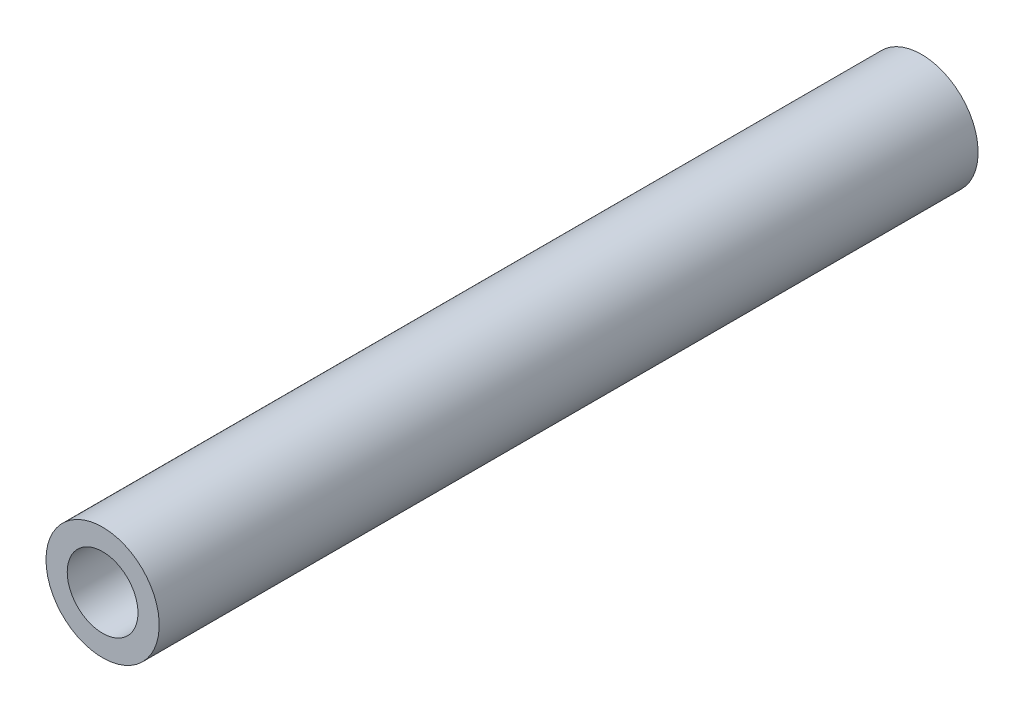
from build123d import *

# Parameters (mm, degrees)
SKETCH_1_R      = 4
SKETCH_1_R_2    = 2.5
EXTRUDE_1_DEPTH = 57.87


with BuildPart() as part:
    # 草图1 → 凸台-拉伸1 (new body)
    with BuildSketch(Plane.XY):
        with Locations(Location((0, 0, 0), (0, 0, 180))):
            Circle(SKETCH_1_R)
        with Locations(Location((0, 0, 0), (0, 0, 180))):
            Circle(SKETCH_1_R_2, mode=Mode.SUBTRACT)
    extrude(amount=EXTRUDE_1_DEPTH)


solid = part.part
